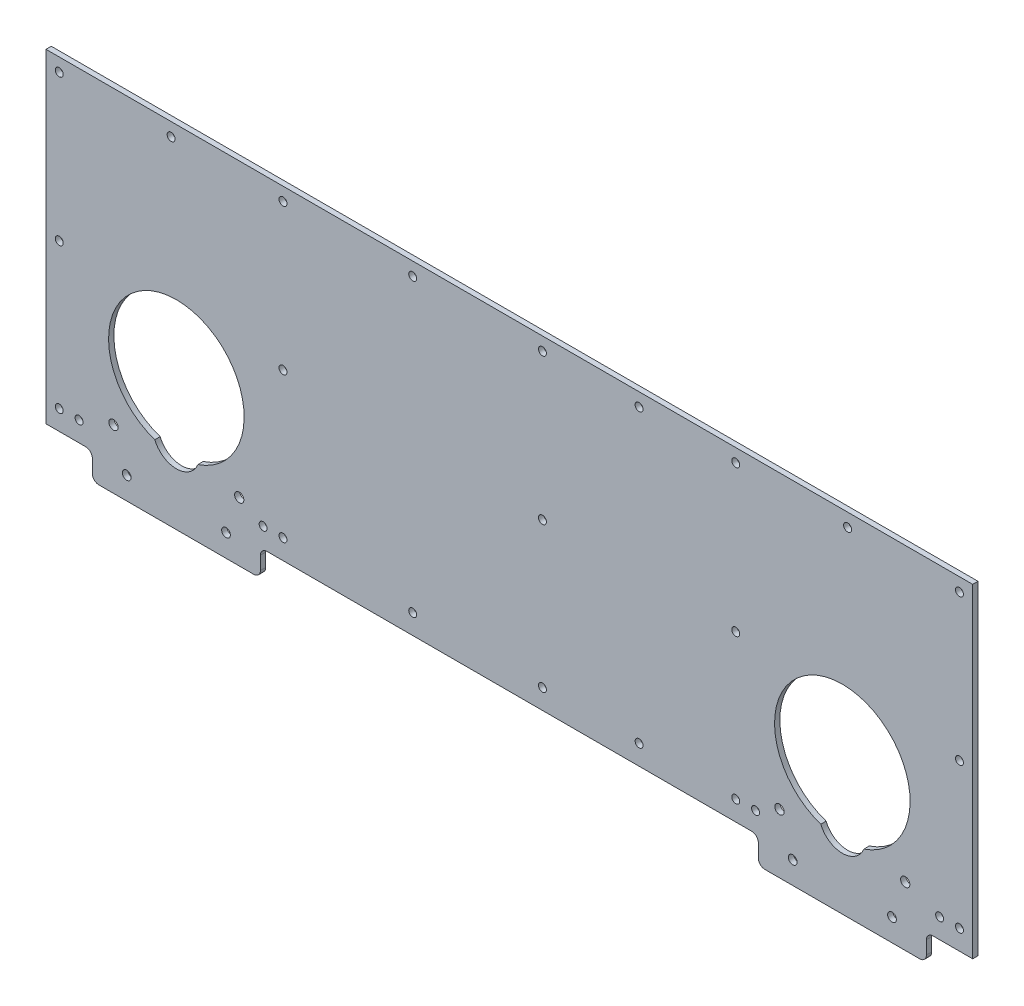
from build123d import *

# Parameters (mm, degrees)
BOSS_EXTRUDE1_DEPTH = 4
SKETCH2_R           = 3.5
SKETCH2_R_2         = 3.302
CUT_EXTRUDE1_DEPTH  = 378.918311279
SKETCH5_R           = 3
CUT_EXTRUDE2_DEPTH  = 378.918311279


with BuildPart() as part:
    # Sketch1 → Boss-Extrude1 (new body)
    with BuildSketch(Plane.XY):
        with BuildLine():
            Line((-350, 122.5), (350, 122.5))
            Line((350, 122.5), (350, -122.5))
            Line((350, -122.5), (320, -122.5))
            ThreePointArc((320, -122.5), (316.464466094, -123.964466094), (315, -127.5))
            Line((315, -127.5), (315, -137.5))
            ThreePointArc((315, -137.5), (313.535533906, -141.035533906), (310, -142.5))
            Line((310, -142.5), (193.06, -142.5))
            ThreePointArc((193.06, -142.5), (189.524466094, -141.035533906), (188.06, -137.5))
            Line((188.06, -137.5), (188.06, -127.5))
            ThreePointArc((188.06, -127.5), (186.595533906, -123.964466094), (183.06, -122.5))
            Line((183.06, -122.5), (-183.06, -122.5))
            ThreePointArc((-183.06, -122.5), (-186.595533906, -123.964466094), (-188.06, -127.5))
            Line((-188.06, -127.5), (-188.06, -137.5))
            ThreePointArc((-188.06, -137.5), (-189.524466094, -141.035533906), (-193.06, -142.5))
            Line((-193.06, -142.5), (-310, -142.5))
            ThreePointArc((-310, -142.5), (-313.535533906, -141.035533906), (-315, -137.5))
            Line((-315, -137.5), (-315, -127.5))
            ThreePointArc((-315, -127.5), (-316.464466094, -123.964466094), (-320, -122.5))
            Line((-320, -122.5), (-350, -122.5))
            Line((-350, -122.5), (-350, 122.5))
        make_face()
    extrude(amount=BOSS_EXTRUDE1_DEPTH)

    # Sketch2 → Cut-Extrude1 (cut, through all)
    with BuildSketch(Plane.XY.offset(4)):
        with Locations((-299.029618848, -97.636758765)):
            Circle(SKETCH2_R)
        with Locations((-204.029618848, -97.636758765)):
            Circle(SKETCH2_R)
        with Locations((-289.030381152, -125.636758765)):
            Circle(SKETCH2_R_2)
        with Locations((-214.030381152, -125.636758765)):
            Circle(SKETCH2_R_2)
        with Locations((204.02961885, -97.636758765)):
            Circle(SKETCH2_R)
        with Locations((299.02961885, -97.636758765)):
            Circle(SKETCH2_R)
        with Locations((214.028856546, -125.636758765)):
            Circle(SKETCH2_R_2)
        with Locations((289.028856546, -125.636758765)):
            Circle(SKETCH2_R_2)
        with BuildLine():
            ThreePointArc((-235.273778228, -91.777635644), (-251.529618848, 7.973241235), (-267.785459469, -91.777635644))
            ThreePointArc((-267.785459469, -91.777635644), (-251.529618848, -102.696758765), (-235.273778228, -91.777635644))
        make_face()
        with BuildLine():
            ThreePointArc((267.78545947, -91.777635644), (251.52961885, 7.973241235), (235.27377823, -91.777635644))
            ThreePointArc((235.27377823, -91.777635644), (251.52961885, -102.696758765), (267.78545947, -91.777635644))
        make_face()
    extrude(amount=-CUT_EXTRUDE1_DEPTH, mode=Mode.SUBTRACT)

    # Sketch5 → Cut-Extrude2 (cut, through all)
    with BuildSketch(Plane.XY.offset(4)):
        with Locations((-340, -107.5)):
            Circle(SKETCH5_R)
        with Locations((-340, 112.5)):
            Circle(SKETCH5_R)
        with Locations((-171, 112.5)):
            Circle(SKETCH5_R)
        with Locations((-171, -107.5)):
            Circle(SKETCH5_R)
        with Locations((171, -107.5)):
            Circle(SKETCH5_R)
        with Locations((340, 112.5)):
            Circle(SKETCH5_R)
        with Locations((340, -107.5)):
            Circle(SKETCH5_R)
        with Locations((171, 112.5)):
            Circle(SKETCH5_R)
        with Locations((25, 112.5)):
            Circle(SKETCH5_R)
        with Locations((25, -107.5)):
            Circle(SKETCH5_R)
        with Locations((-255.5, 112.5)):
            Circle(SKETCH5_R)
        with Locations((98, 112.5)):
            Circle(SKETCH5_R)
        with Locations((255.5, 112.5)):
            Circle(SKETCH5_R)
        with Locations((340, 2.25)):
            Circle(SKETCH5_R)
        with Locations((171, 2)):
            Circle(SKETCH5_R)
        with Locations((25, 2.25)):
            Circle(SKETCH5_R)
        with Locations((-171, 2.25)):
            Circle(SKETCH5_R)
        with Locations((-340, 2.25)):
            Circle(SKETCH5_R)
        with Locations((-73, 112.5)):
            Circle(SKETCH5_R)
        with Locations((-73, -107.5)):
            Circle(SKETCH5_R)
        with Locations((-325, -107.5)):
            Circle(SKETCH5_R)
        with Locations((186, -107.5)):
            Circle(SKETCH5_R)
        with Locations((325, -107.5)):
            Circle(SKETCH5_R)
        with Locations((-186, -107.5)):
            Circle(SKETCH5_R)
        with Locations((98, -107.5)):
            Circle(SKETCH5_R)
    extrude(amount=-CUT_EXTRUDE2_DEPTH, mode=Mode.SUBTRACT)


solid = part.part
